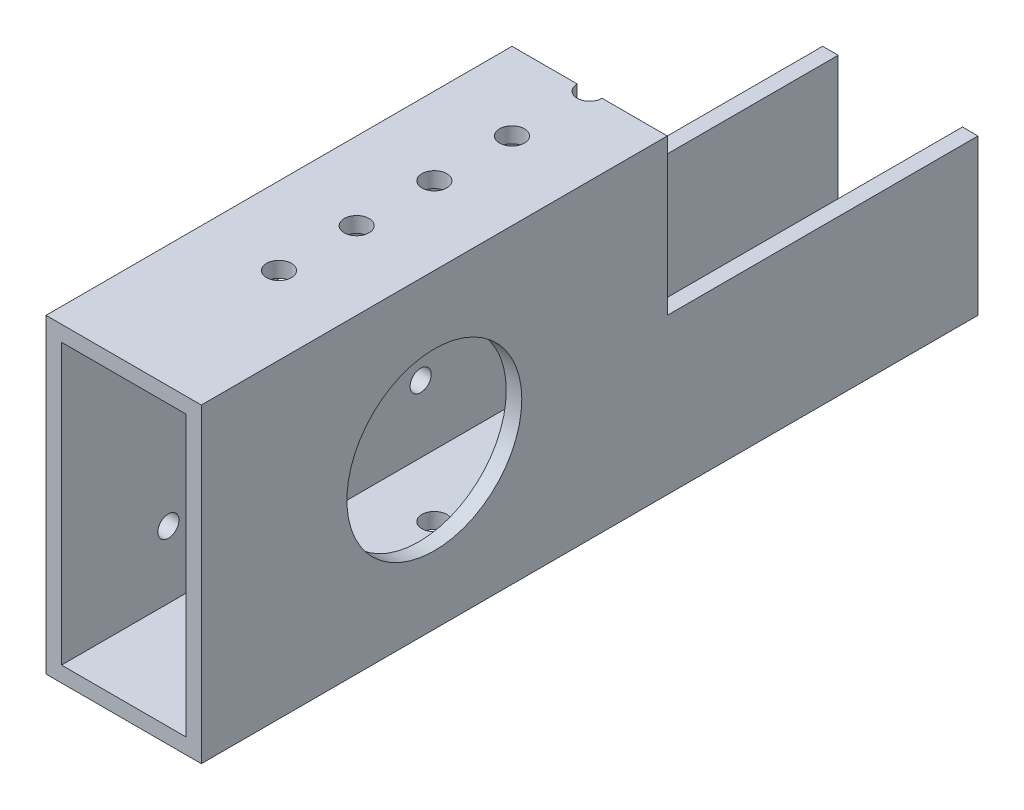
from build123d import *

# Parameters (mm, degrees)
SKETCH1_W                 = 25.4
SKETCH1_H                 = 50.8
SKETCH1_W_2               = 20.32
SKETCH1_H_2               = 45.72
BOSS_EXTRUDE1_DEPTH       = 127
SKETCH2_R                 = 2.032
CUT_EXTRUDE1_DEPTH        = 138.371503595
SKETCH3_R                 = 14.3002
CUT_EXTRUDE2_DEPTH        = 132.982271537
CUT_EXTRUDE3_REACH        = 133.982
SKETCH4_W                 = 50.8
SKETCH4_H                 = 25.4
F_8_32_TAPPED_HOLE1_D     = 3.4544
F_8_32_TAPPED_HOLE1_DEPTH = 2.54


with BuildPart() as part:
    # Sketch1 → Boss-Extrude1 (new body)
    with BuildSketch(Plane.XY):
        Rectangle(SKETCH1_W, SKETCH1_H)
        Rectangle(SKETCH1_W_2, SKETCH1_H_2, mode=Mode.SUBTRACT)
    extrude(amount=BOSS_EXTRUDE1_DEPTH)

    # Sketch2 → Cut-Extrude1 (cut, through all)
    with BuildSketch(Plane(origin=(0, 25.4, 0), x_dir=(1, 0, 0), z_dir=(0, 1, 0))):
        with Locations(Location((0, -12.7, 0), (0, 0, 270))):
            Circle(SKETCH2_R)
        with Locations(Location((0, -25.4, 0), (0, 0, 270))):
            Circle(SKETCH2_R)
        with Locations(Location((0, -38.1, 0), (0, 0, 270))):
            Circle(SKETCH2_R)
        with Locations(Location((0, -50.8, 0), (0, 0, 270))):
            Circle(SKETCH2_R)
        with Locations(Location((0, -63.5, 0), (0, 0, 270))):
            Circle(SKETCH2_R)
        with Locations(Location((0, -76.2, 0), (0, 0, 270))):
            Circle(SKETCH2_R)
        with Locations(Location((0, -88.9, 0), (0, 0, 270))):
            Circle(SKETCH2_R)
        with Locations(Location((0, -101.6, 0), (0, 0, 270))):
            Circle(SKETCH2_R)
    extrude(amount=-CUT_EXTRUDE1_DEPTH, mode=Mode.SUBTRACT)

    # Sketch3 → Cut-Extrude2 (cut, through all)
    with BuildSketch(Plane(origin=(12.7, 0, 0), x_dir=(0, 0, -1), z_dir=(1, 0, 0))):
        with Locations((-88.9, 0)):
            Circle(SKETCH3_R)
    extrude(amount=-CUT_EXTRUDE2_DEPTH, mode=Mode.SUBTRACT)

    # Sketch4 → Cut-Extrude3 (cut, up to next)
    with BuildSketch(Plane.ZY.offset(12.7), mode=Mode.PRIVATE) as cut_extrude3_sk1:
        with Locations((25.4, 12.7)):
            Rectangle(SKETCH4_W, SKETCH4_H)
    cut_extrude3_tool1 = extrude(cut_extrude3_sk1.sketch, amount=-CUT_EXTRUDE3_REACH, mode=Mode.PRIVATE) & part.part
    add(cut_extrude3_tool1.solids().sort_by_distance((-12.7, 12.7, 25.4))[0], mode=Mode.SUBTRACT)

    # #8-32 Tapped Hole1
    with Locations(Plane.ZY.offset(12.7)):
        with Locations((109.522229928, 11.90625), (109.522229928, -11.90625), (68.277770072, -11.90625), (68.277770072, 11.90625)):
            Hole(F_8_32_TAPPED_HOLE1_D / 2, depth=F_8_32_TAPPED_HOLE1_DEPTH)


solid = part.part
